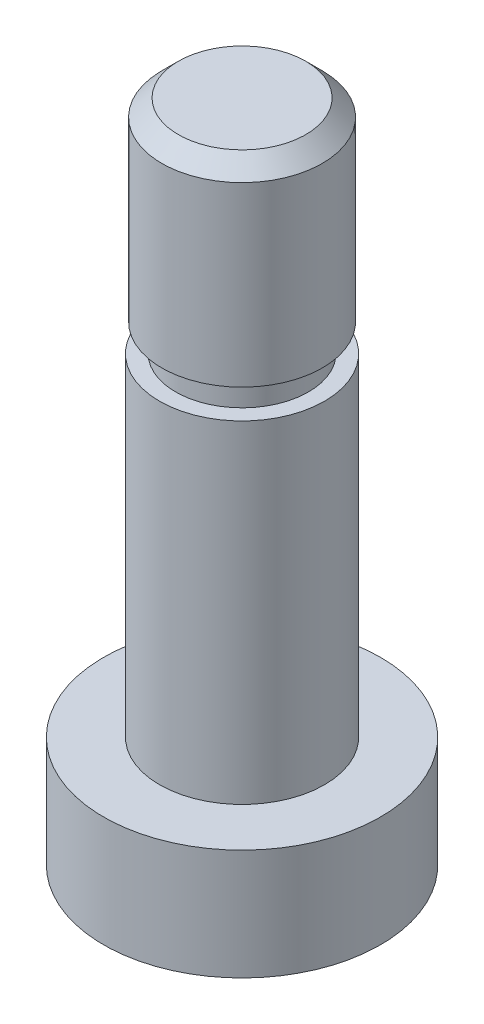
from build123d import *

# Parameters (mm, degrees)
ENL_V_START             = -2
ENL_V_MAT_EXTRU_1_DEPTH = 1.3


with BuildPart() as part:
    # Esquisse1 → Révolution1 (revolve)
    with BuildSketch(Plane.XY, mode=Mode.PRIVATE) as r_volution1_sk:
        Polygon((0, -2), (2.5, -2), (2.5, 0), (2.3, 0), (1.49, 0), (1.49, 6), (1.2, 6), (1.2, 6.5), (1.45, 6.5), (1.45, 9.7), (1.15, 10), (0, 10), align=None)
    revolve(r_volution1_sk.sketch.rotate(Axis((0, -4, 0), (0, 1, 0)), 90), axis=Axis((0, -4, 0), (0, 1, 0)))

    # Esquisse2 → Enlèv. mat.-Extru.1 (cut)
    with BuildSketch(Plane(origin=(0, 0, 0), x_dir=(1, 0, 0), z_dir=(0, 1, 0)).offset(ENL_V_START)):
        Polygon((1.154700538, 0), (0.577350269, 1), (-0.577350269, 1), (-1.154700538, 0), (-0.577350269, -1), (0.577350269, -1), align=None)
    extrude(amount=ENL_V_MAT_EXTRU_1_DEPTH, mode=Mode.SUBTRACT)


solid = part.part
